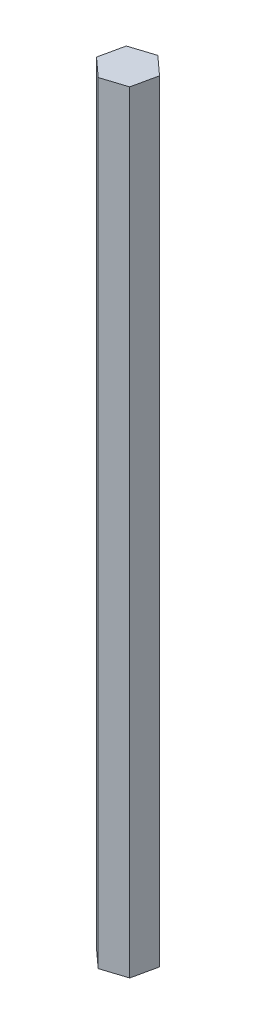
from build123d import *

# Parameters (mm, degrees)
BOSS_EXTRUDE1_DEPTH = 127
SKETCH3_W           = 20.194547067
SKETCH3_H           = 18.170773651
CUT_EXTRUDE1_DEPTH  = 38.1


with BuildPart() as part:
    # Sketch2 → Boss-Extrude1 (new body)
    with BuildSketch(Plane(origin=(0, 0, 0), x_dir=(1, 0, 0), z_dir=(0, 1, 0))):
        Polygon((2.137295047, -1.940438924), (2.749116926, 0.880732344), (0.611821879, 2.821171268), (-2.137295047, 1.940438924), (-2.749116926, -0.880732344), (-0.611821879, -2.821171268), align=None)
    extrude(amount=BOSS_EXTRUDE1_DEPTH)

    # Sketch3 → Cut-Extrude1 (cut)
    with BuildSketch(Plane.XZ):
        with Locations((-3.121926418, 0.771419978)):
            Rectangle(SKETCH3_W, SKETCH3_H)
    extrude(amount=-CUT_EXTRUDE1_DEPTH, mode=Mode.SUBTRACT)


solid = part.part
